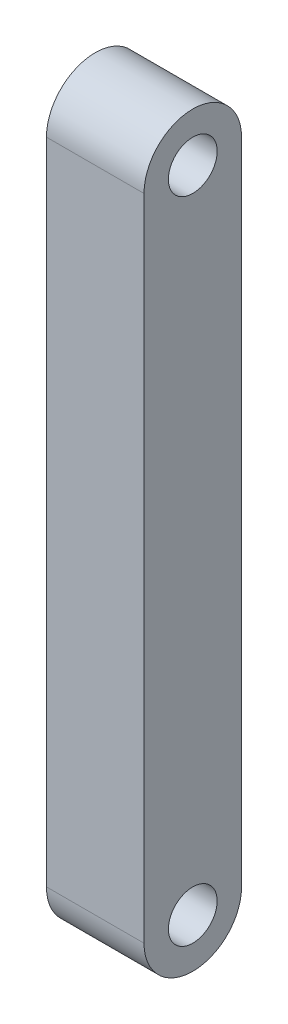
from build123d import *

# Parameters (mm, degrees)
SKETCH1_R           = 1
BOSS_EXTRUDE1_DEPTH = 4


with BuildPart() as part:
    # Sketch1 → Boss-Extrude1 (new body)
    with BuildSketch(Plane(origin=(0, 0, 0), x_dir=(0, 0, -1), z_dir=(1, 0, 0))):
        with BuildLine():
            Line((-0.38118507, -13.31), (-0.38118507, 13.31))
            ThreePointArc((-0.38118507, 13.31), (1.61881493, 15.31), (3.61881493, 13.31))
            Line((3.61881493, 13.31), (3.61881493, -13.31))
            ThreePointArc((3.61881493, -13.31), (1.61881493, -15.31), (-0.38118507, -13.31))
        make_face()
        with Locations((1.61881493, 13.31)):
            Circle(SKETCH1_R, mode=Mode.SUBTRACT)
        with Locations((1.61881493, -13.31)):
            Circle(SKETCH1_R, mode=Mode.SUBTRACT)
    extrude(amount=BOSS_EXTRUDE1_DEPTH)


solid = part.part
